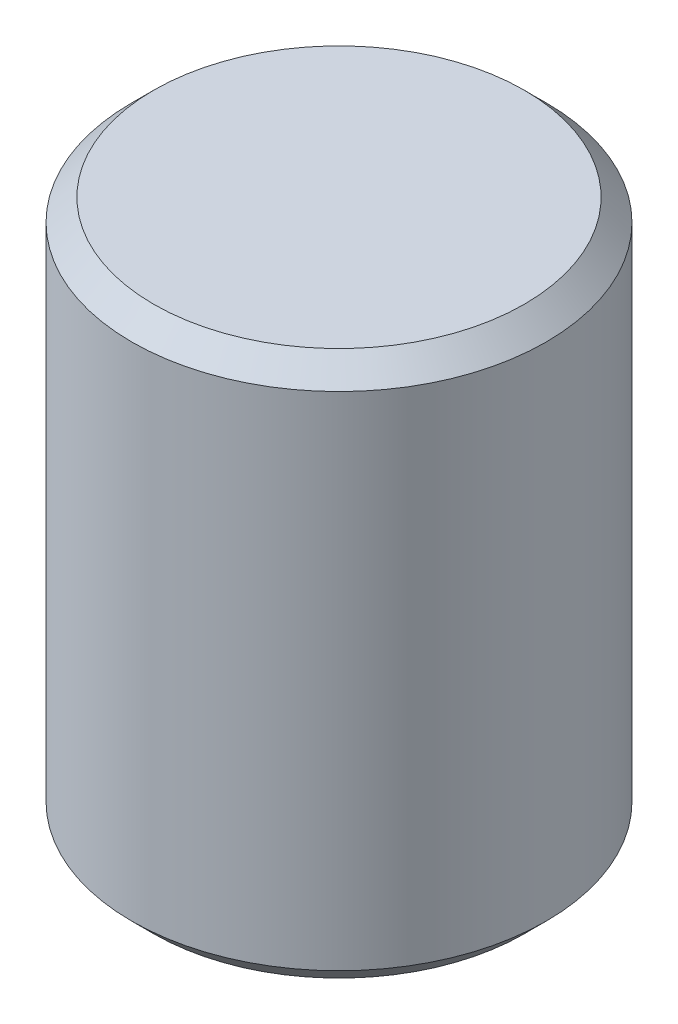
from build123d import *

# Parameters (mm, degrees)
SKETCH1_R           = 9.5
BOSS_EXTRUDE1_DEPTH = 25
CHAMFER1_SIZE       = 1


with BuildPart() as part:
    # Sketch1 → Boss-Extrude1 (new body)
    with BuildSketch(Plane(origin=(0, 0, 0), x_dir=(1, 0, 0), z_dir=(0, 1, 0))):
        with Locations(Location((0, 0, 0), (0, 0, 270))):
            Circle(SKETCH1_R)
    extrude(amount=BOSS_EXTRUDE1_DEPTH)

    # Chamfer1
    chamfer1_edges = [part.edges().sort_by_distance(p)[0] for p in [
        (0, 0, -9.5),
        (0, 25, -9.5),
    ]]
    chamfer(chamfer1_edges, length=CHAMFER1_SIZE)


solid = part.part
